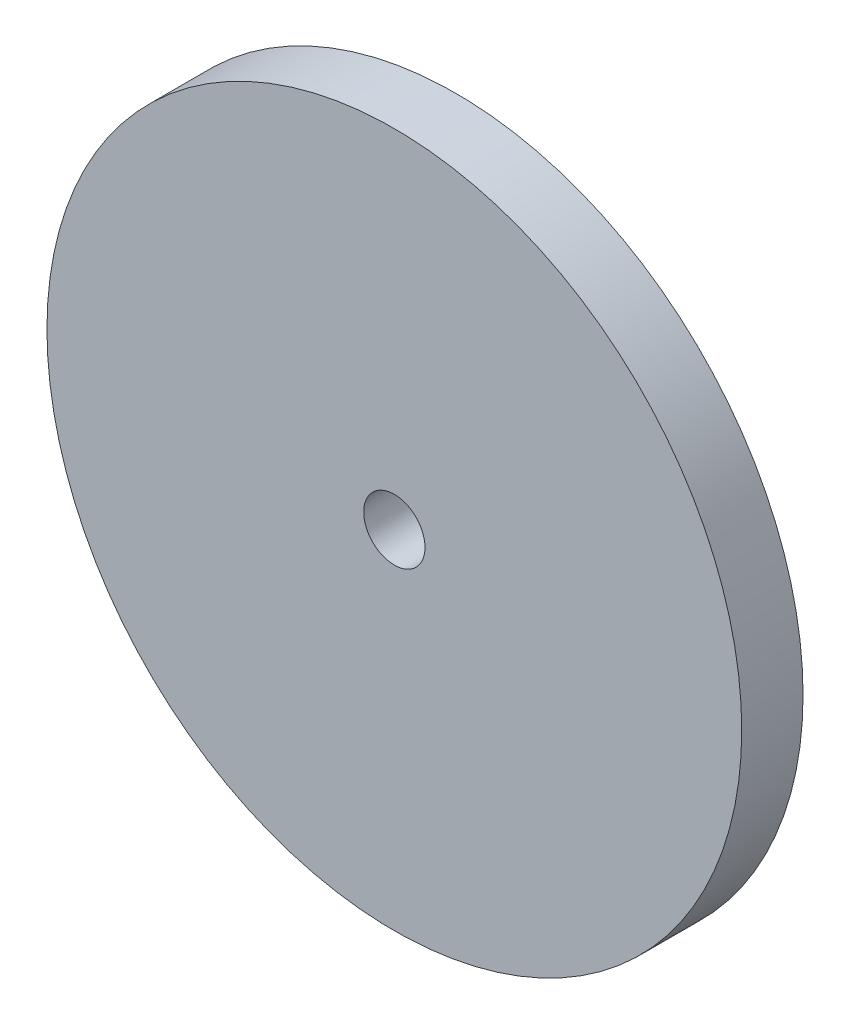
from build123d import *

# Parameters (mm, degrees)
SKETCH4_R           = 17
BOSS_EXTRUDE2_DEPTH = 3
SKETCH3_R           = 1.5
CUT_EXTRUDE4_DEPTH  = 25.228082879


with BuildPart() as part:
    # Sketch4 → Boss-Extrude2 (new body)
    with BuildSketch(Plane.XY):
        Circle(SKETCH4_R)
    extrude(amount=BOSS_EXTRUDE2_DEPTH)

    # Sketch3 → Cut-Extrude4 (cut, through all)
    with BuildSketch(Plane(origin=(0, 0, 0), x_dir=(-1, 0, 0), z_dir=(0, 0, 1))):
        with Locations(Location((0, 0, 0), (0, 0, 180))):
            Circle(SKETCH3_R)
    extrude(amount=CUT_EXTRUDE4_DEPTH, mode=Mode.SUBTRACT)


solid = part.part
